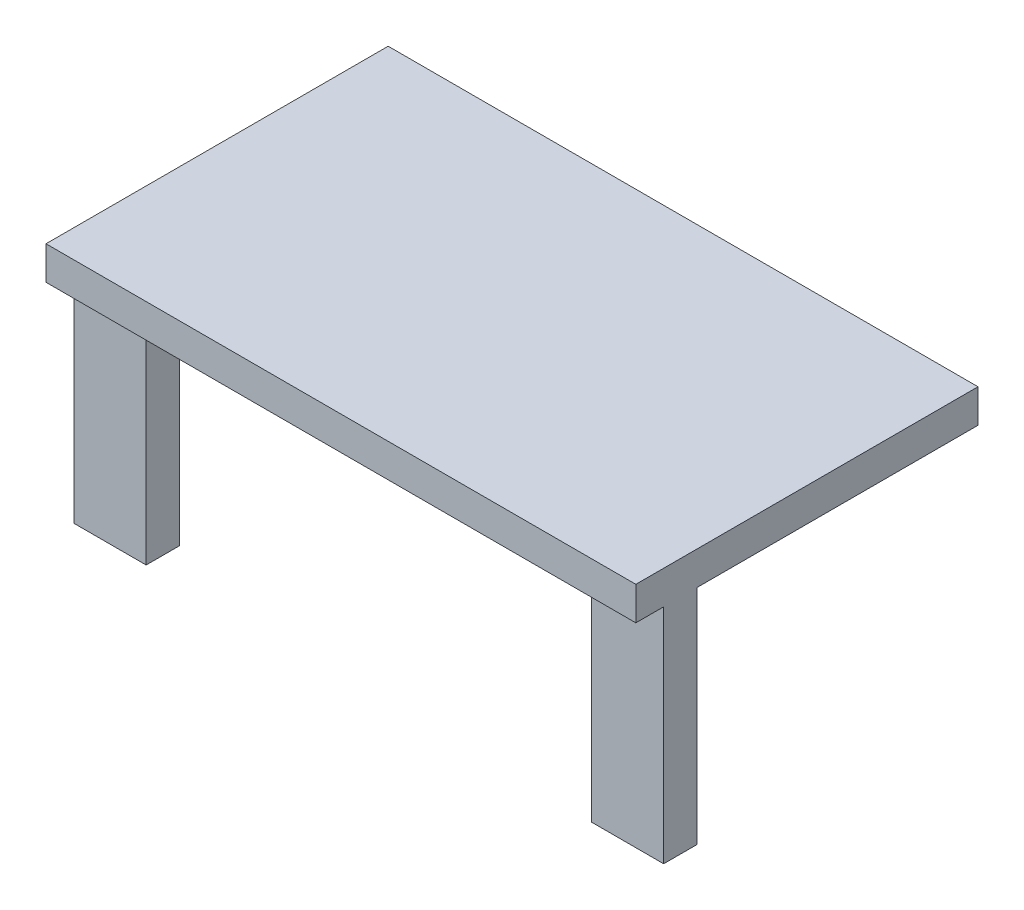
from build123d import *

# Parameters (mm, degrees)
SKETCH1_W           = 53
SKETCH1_H           = 30.745586227
BOSS_EXTRUDE1_DEPTH = 3
SKETCH2_W           = 6.5
SKETCH2_H           = 3
BOSS_EXTRUDE2_DEPTH = 20


with BuildPart() as part:
    # Sketch1 → Boss-Extrude1 (new body)
    with BuildSketch(Plane(origin=(0, 0, 0), x_dir=(1, 0, 0), z_dir=(0, 1, 0))):
        with Locations((24.118089155, -22.118099476)):
            Rectangle(SKETCH1_W, SKETCH1_H)
    extrude(amount=BOSS_EXTRUDE1_DEPTH)

    # Sketch2 → Boss-Extrude2 (add)
    with BuildSketch(Plane.XZ):
        with Locations((47.368089155, 33.49089259)):
            Rectangle(SKETCH2_W, SKETCH2_H)
        with Locations((0.868089155, 33.49089259)):
            Rectangle(SKETCH2_W, SKETCH2_H)
    extrude(amount=BOSS_EXTRUDE2_DEPTH)


solid = part.part
